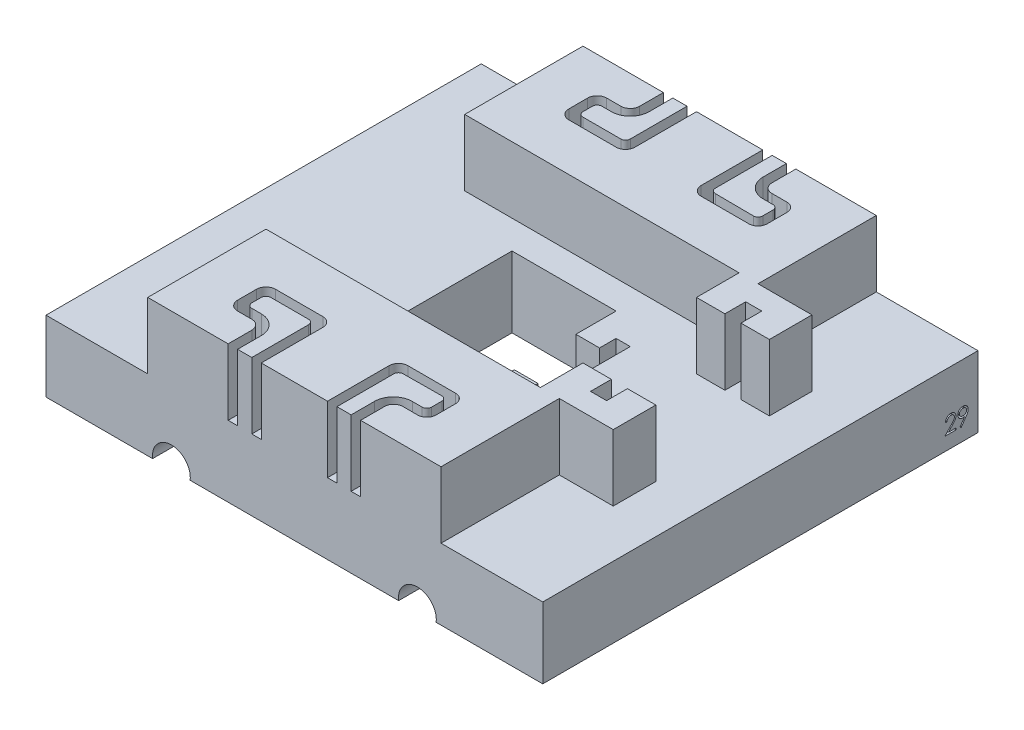
from build123d import *

# Parameters (mm, degrees)
SKETCH1_W               = 105
SKETCH1_H               = 92
BOSS_EXTRUDE1_DEPTH     = 15
SKETCH2_W               = 30
SKETCH2_H               = 30
CUT_EXTRUDE1_DEPTH      = 72
BOSS_EXTRUDE4_DEPTH     = 15
CUT_EXTRUDE2_DEPTH      = 84
CUT_EXTRUDE2_DEPTH_BACK = 64
SKETCH18_R              = 4
CUT_EXTRUDE3_DEPTH      = 10
CUT_EXTRUDE3_DEPTH_BACK = 10
SKETCH22_R              = 6
CUT_EXTRUDE4_DEPTH      = 10
CUT_EXTRUDE4_DEPTH_BACK = 10
SKETCH23_R              = 6
CUT_EXTRUDE5_DEPTH      = 10
CUT_EXTRUDE5_DEPTH_BACK = 10
SKETCH24_R              = 6
CUT_EXTRUDE7_DEPTH      = 2
CUT_EXTRUDE8_DEPTH      = 2
BOSS_EXTRUDE5_DEPTH     = 14


with BuildPart() as part:
    # Sketch1 → Boss-Extrude1 (new body)
    with BuildSketch(Plane(origin=(0, 0, 0), x_dir=(1, 0, 0), z_dir=(0, 1, 0))):
        with Locations((52.5, 46)):
            Rectangle(SKETCH1_W, SKETCH1_H)
    extrude(amount=BOSS_EXTRUDE1_DEPTH)

    # Sketch2 → Cut-Extrude1 (cut)
    with BuildSketch(Plane(origin=(0, 15, 0), x_dir=(1, 0, 0), z_dir=(0, 1, 0))):
        with Locations((52.5, 46)):
            Rectangle(SKETCH2_W, SKETCH2_H)
    extrude(amount=-CUT_EXTRUDE1_DEPTH, mode=Mode.SUBTRACT)

    # Sketch15 → Boss-Extrude4 (add)
    with BuildSketch(Plane(origin=(0, 15, 0), x_dir=(1, 0, 0), z_dir=(0, 1, 0))):
        Polygon((72.5, 67), (72.5, 46), (72.5, 25), (59.5, 25), (59.5, 31), (59.5, 39.5), (64.5, 39.5), (64.5, 36), (67.5, 36), (67.5, 46), (67.5, 56), (64.5, 56), (64.5, 52.5), (59.5, 52.5), (59.5, 61), (59.5, 67), align=None)
    extrude(amount=-BOSS_EXTRUDE4_DEPTH)

    # Sketch18 → Cut-Extrude2 (cut, two sides: drawn at the far end of the back side and taken through both)
    with BuildSketch(Plane.XY.offset(-46).offset(-CUT_EXTRUDE2_DEPTH_BACK)):
        with Locations((26.5, 0.5)):
            Circle(SKETCH18_R)
        with Locations((78.5, 0.5)):
            Circle(SKETCH18_R)
    extrude(amount=CUT_EXTRUDE2_DEPTH + CUT_EXTRUDE2_DEPTH_BACK, mode=Mode.SUBTRACT)

    # Sketch22 → Cut-Extrude3 (cut, two sides: drawn at the far end of the back side and taken through both)
    with BuildSketch(Plane.XY.offset(-46).offset(-CUT_EXTRUDE3_DEPTH_BACK)):
        with Locations((26.5, 0.5)):
            Circle(SKETCH22_R)
    extrude(amount=CUT_EXTRUDE3_DEPTH + CUT_EXTRUDE3_DEPTH_BACK, mode=Mode.SUBTRACT)

    # Sketch23 → Cut-Extrude4 (cut, two sides: drawn at the far end of the back side and taken through both)
    with BuildSketch(Plane(origin=(0, 0, -69), x_dir=(-1, 0, 0), z_dir=(0, 0, -1)).offset(-CUT_EXTRUDE4_DEPTH_BACK)):
        with Locations((-78.5, 0.5)):
            Circle(SKETCH23_R)
    extrude(amount=CUT_EXTRUDE4_DEPTH + CUT_EXTRUDE4_DEPTH_BACK, mode=Mode.SUBTRACT)

    # Sketch24 → Cut-Extrude5 (cut, two sides: drawn at the far end of the back side and taken through both)
    with BuildSketch(Plane.XY.offset(-23).offset(-CUT_EXTRUDE5_DEPTH_BACK)):
        with Locations((78.5, 0.5)):
            Circle(SKETCH24_R)
    extrude(amount=CUT_EXTRUDE5_DEPTH + CUT_EXTRUDE5_DEPTH_BACK, mode=Mode.SUBTRACT)

    # Sketch27 → Cut-Extrude7 (cut)
    # profile 1 of 2: a face of its own
    with BuildSketch(Plane.ZY):
        with BuildLine():
            Line((-6.628929061, 4.581451926), (-6.943031625, 4.581451926))
            add(Edge.make_bspline(
                [(-6.943031625, 4.581451926), (-6.940984472, 4.623122814), (-6.936963918, 4.704963329), (-6.918135629, 4.824287235), (-6.891194752, 4.938342034), (-6.853103298, 5.046211948), (-6.80579702, 5.148850755), (-6.749066993, 5.245850771), (-6.681873142, 5.336841959), (-6.605666408, 5.420980803), (-6.522897769, 5.498168374), (-6.43359183, 5.564823616), (-6.339746802, 5.621141288), (-6.241647403, 5.66822253), (-6.13818684, 5.703562375), (-6.030303982, 5.729784015), (-5.917524846, 5.745560361), (-5.840684824, 5.747256146), (-5.801605343, 5.748118593)],
                knots=[0, 0, 0, 0, 1.10065271, 2.161652631, 3.183658789, 4.190468796, 5.17591951, 6.163126047, 7.15150782, 8.156236427, 9.156009102, 10.134482811, 11.092018607, 12.041330605, 13.001268258, 13.972401359, 14.968799086, 16, 16, 16, 16], degree=3))
            add(Edge.make_bspline(
                [(-5.801605343, 5.748118593), (-5.763227269, 5.747220137), (-5.687815725, 5.745454702), (-5.57775371, 5.730293673), (-5.472976416, 5.706548081), (-5.373688649, 5.673232665), (-5.280682585, 5.628448237), (-5.19325954, 5.574650699), (-5.110378729, 5.512430867), (-5.035771946, 5.439177054), (-4.967263866, 5.360974669), (-4.908161611, 5.277486766), (-4.857548448, 5.19125748), (-4.815360768, 5.101629278), (-4.784304629, 5.00775825), (-4.760726421, 4.911011047), (-4.747399007, 4.810386236), (-4.745353584, 4.74227968), (-4.744313677, 4.707653849)],
                knots=[0, 0, 0, 0, 1.111607364, 2.184268762, 3.212621178, 4.221274766, 5.211760367, 6.196651075, 7.1921475, 8.207485113, 9.220403448, 10.201281604, 11.166441695, 12.114753415, 13.065576456, 14.026450734, 14.996634279, 16, 16, 16, 16], degree=3))
            add(Edge.make_bspline(
                [(-4.744313677, 4.707653849), (-4.74600694, 4.658906015), (-4.749363751, 4.562265801), (-4.778078128, 4.420250938), (-4.822924639, 4.282657519), (-4.876921995, 4.171920217), (-4.93139444, 4.082686724), (-4.980481947, 4.009218019), (-5.037946758, 3.93011255), (-5.104625256, 3.845635213), (-5.179138128, 3.755124308), (-5.262160292, 3.658634512), (-5.354283774, 3.557162743), (-5.418942274, 3.487857141), (-5.45244669, 3.451944715)],
                knots=[0, 0, 0, 0, 1.184426356, 2.348067706, 3.509069118, 4.696110526, 5.333549288, 6.050745305, 6.844228056, 7.710549037, 8.667450064, 9.695053472, 10.805634456, 12, 12, 12, 12], degree=3))
            Line((-5.45244669, 3.451944715), (-6.328147811, 2.517349362))
            Line((-6.328147811, 2.517349362), (-4.699441882, 2.517349362))
            Line((-4.699441882, 2.517349362), (-4.699441882, 2.158375003))
            Line((-4.699441882, 2.158375003), (-7.07764701, 2.158375003))
            Line((-7.07764701, 2.158375003), (-5.720275215, 3.606892632))
            add(Edge.make_bspline(
                [(-5.720275215, 3.606892632), (-5.687227328, 3.641390938), (-5.623749101, 3.707655125), (-5.533966524, 3.804398085), (-5.453327536, 3.894147626), (-5.381310143, 3.976734174), (-5.319476638, 4.053365742), (-5.264604406, 4.121560445), (-5.220638815, 4.184314896), (-5.172923419, 4.25705551), (-5.126709438, 4.345867827), (-5.086997082, 4.454401516), (-5.062782234, 4.566128769), (-5.059877398, 4.641630806), (-5.058416241, 4.679608978)],
                knots=[0, 0, 0, 0, 1.329631726, 2.553950428, 3.673215718, 4.687767853, 5.603093632, 6.413772471, 7.123043292, 7.734684054, 8.834405432, 9.900288307, 10.943827018, 12, 12, 12, 12], degree=3))
            add(Edge.make_bspline(
                [(-5.058416241, 4.679608978), (-5.059051983, 4.703490376), (-5.060304909, 4.750556026), (-5.071362607, 4.819561785), (-5.088073113, 4.886126599), (-5.112018371, 4.950455218), (-5.143625111, 5.01190087), (-5.182098491, 5.070538351), (-5.226488554, 5.127227316), (-5.277839824, 5.180380614), (-5.334251343, 5.229061819), (-5.393845593, 5.272185905), (-5.456895697, 5.308225016), (-5.523135819, 5.337768513), (-5.592381289, 5.360943894), (-5.664766034, 5.377002473), (-5.74009005, 5.387084957), (-5.791523546, 5.388449129), (-5.817731145, 5.389144234)],
                knots=[0, 0, 0, 0, 0.991446411, 1.95395049, 2.89581595, 3.838931463, 4.798493298, 5.75982156, 6.748411868, 7.785213223, 8.824556874, 9.840280684, 10.836137867, 11.835679398, 12.848801643, 13.863922112, 14.911575587, 16, 16, 16, 16], degree=3))
            add(Edge.make_bspline(
                [(-5.817731145, 5.389144234), (-5.845101977, 5.388429202), (-5.898853774, 5.387024997), (-5.977772807, 5.377202333), (-6.053058584, 5.360256492), (-6.124900487, 5.337079818), (-6.193420073, 5.307621269), (-6.258284117, 5.270929524), (-6.319347006, 5.227146031), (-6.37672353, 5.177505475), (-6.429587509, 5.122237874), (-6.476034384, 5.06062791), (-6.516618399, 4.993800495), (-6.552027632, 4.921935945), (-6.580783322, 4.844382165), (-6.602756473, 4.76141446), (-6.620143319, 4.673393078), (-6.62595184, 4.612607993), (-6.628929061, 4.581451926)],
                knots=[0, 0, 0, 0, 1.031018746, 2.02475058, 2.990194455, 3.934040569, 4.864654155, 5.795059489, 6.735614925, 7.690564532, 8.649604399, 9.611025574, 10.590972636, 11.591080095, 12.624614302, 13.701020113, 14.821632451, 16, 16, 16, 16], degree=3))
        make_face()
    # profile 2 of 2: a face of its own
    with BuildSketch(Plane.ZY):
        with BuildLine():
            Line((-3.622518805, 2.068631414), (-3.873520408, 2.24321074))
            Line((-3.873520408, 2.24321074), (-2.900363356, 3.665786862))
            add(Edge.make_bspline(
                [(-2.900363356, 3.665786862), (-2.962454092, 3.658193799), (-3.084714212, 3.643242634), (-3.207851314, 3.640495979), (-3.268452299, 3.639144234)],
                knots=[0, 0, 0, 0, 1.015715272, 2, 2, 2, 2], degree=3))
            add(Edge.make_bspline(
                [(-3.268452299, 3.639144234), (-3.305194346, 3.640085311), (-3.377315773, 3.641932561), (-3.483347426, 3.65657437), (-3.585232986, 3.679124497), (-3.682702342, 3.712773252), (-3.776121847, 3.754591461), (-3.86528756, 3.806448475), (-3.950079451, 3.867454767), (-4.029586861, 3.937287758), (-4.1018986, 4.013965811), (-4.166321898, 4.095121454), (-4.21986303, 4.181697424), (-4.264339615, 4.271927644), (-4.298070068, 4.367108995), (-4.322632606, 4.466158395), (-4.33775496, 4.569770037), (-4.339554056, 4.640295168), (-4.340467523, 4.676103369)],
                knots=[0, 0, 0, 0, 1.060718605, 2.082097864, 3.085795603, 4.069760067, 5.054557537, 6.03741023, 7.043284206, 8.066802108, 9.088538119, 10.083643548, 11.053783639, 12.022749082, 12.983451788, 13.964007469, 14.966251758, 16, 16, 16, 16], degree=3))
            add(Edge.make_bspline(
                [(-4.340467523, 4.676103369), (-4.338733088, 4.725072021), (-4.335328744, 4.821187553), (-4.307930227, 4.961621322), (-4.262869888, 5.094407866), (-4.200041511, 5.21919806), (-4.12090679, 5.334196799), (-4.0257982, 5.437805408), (-3.915294235, 5.528550262), (-3.791912216, 5.606554339), (-3.658559195, 5.669289336), (-3.518890537, 5.715528637), (-3.373976417, 5.742727385), (-3.275808747, 5.746313246), (-3.226384991, 5.748118593)],
                knots=[0, 0, 0, 0, 1.022988612, 2.007919123, 2.978103895, 3.94594894, 4.918897164, 5.887013414, 6.875921846, 7.89917871, 8.930658928, 9.948724884, 10.967259574, 12, 12, 12, 12], degree=3))
            add(Edge.make_bspline(
                [(-3.226384991, 5.748118593), (-3.177896571, 5.74628843), (-3.082088024, 5.7426722), (-2.941199018, 5.716188231), (-2.806258001, 5.671551558), (-2.678013014, 5.609866995), (-2.559273602, 5.532546087), (-2.452497791, 5.440411563), (-2.360122252, 5.333406036), (-2.282298371, 5.214117546), (-2.219828331, 5.085950565), (-2.174756048, 4.952166642), (-2.147010409, 4.813727921), (-2.143514082, 4.719933447), (-2.141749574, 4.67259776)],
                knots=[0, 0, 0, 0, 1.026385292, 2.028040595, 3.023318987, 4.028184125, 5.03290303, 6.015178782, 7.004435299, 8.016004309, 9.023023918, 10.015172535, 10.998308025, 12, 12, 12, 12], degree=3))
            add(Edge.make_bspline(
                [(-2.141749574, 4.67259776), (-2.142927983, 4.635853993), (-2.145318091, 4.561328452), (-2.162054398, 4.448098109), (-2.190474583, 4.33264688), (-2.222726282, 4.234925284), (-2.25385845, 4.154216834), (-2.283159581, 4.090465254), (-2.315671735, 4.023363991), (-2.3535905, 3.953616653), (-2.394352797, 3.880334118), (-2.440412074, 3.804251402), (-2.490717645, 3.725266409), (-2.526547365, 3.672019321), (-2.544894606, 3.644753208)],
                knots=[0, 0, 0, 0, 1.179839688, 2.393009684, 3.667231171, 4.993948276, 5.694988576, 6.444077775, 7.246288328, 8.089075292, 8.993003841, 9.939041771, 10.944649915, 12, 12, 12, 12], degree=3))
            Line((-2.544894606, 3.644753208), (-3.622518805, 2.068631414))
        make_face()
        with BuildLine():
            add(Edge.make_bspline(
                [(-3.21025919, 3.998118593), (-3.182425175, 3.998878977), (-3.128241812, 4.000359186), (-3.048864513, 4.009368427), (-2.97394031, 4.025342414), (-2.903269061, 4.048262126), (-2.836142159, 4.075918794), (-2.773625831, 4.111130781), (-2.715667755, 4.153147415), (-2.661879828, 4.200357431), (-2.614115829, 4.252808015), (-2.571572798, 4.307705121), (-2.53541223, 4.365289731), (-2.506848953, 4.426282994), (-2.483364378, 4.489200202), (-2.467146366, 4.555054557), (-2.458162033, 4.623502958), (-2.456630458, 4.670001616), (-2.455852138, 4.693631414)],
                knots=[0, 0, 0, 0, 1.163407946, 2.26475976, 3.333800367, 4.359385343, 5.366239384, 6.363380779, 7.350133999, 8.353570782, 9.349036268, 10.310270964, 11.253520213, 12.184142, 13.120487599, 14.056272588, 15.012232024, 16, 16, 16, 16], degree=3))
            add(Edge.make_bspline(
                [(-2.455852138, 4.693631414), (-2.456521807, 4.717271079), (-2.457841473, 4.763855939), (-2.468428772, 4.832405679), (-2.487053996, 4.898098939), (-2.51204448, 4.961295369), (-2.544964718, 5.021475741), (-2.584468204, 5.079395613), (-2.631400654, 5.134687741), (-2.68540322, 5.186051724), (-2.743637773, 5.233399624), (-2.805698273, 5.2751857), (-2.871073189, 5.310206896), (-2.939363679, 5.339105866), (-3.010712028, 5.361657642), (-3.085076016, 5.377875006), (-3.162831422, 5.386846761), (-3.215612708, 5.388368655), (-3.242510792, 5.389144234)],
                knots=[0, 0, 0, 0, 0.972161553, 1.915763587, 2.844109794, 3.775983486, 4.705125789, 5.659731448, 6.655561913, 7.682237399, 8.721216875, 9.739758359, 10.754845918, 11.767244016, 12.7857855, 13.828538656, 14.893392813, 16, 16, 16, 16], degree=3))
            add(Edge.make_bspline(
                [(-3.242510792, 5.389144234), (-3.269174946, 5.388367402), (-3.321489795, 5.386843265), (-3.398553954, 5.37789206), (-3.472415122, 5.361548576), (-3.543556742, 5.339116312), (-3.611845203, 5.31020474), (-3.677217036, 5.275183865), (-3.739292052, 5.233409242), (-3.797470773, 5.18601447), (-3.851568695, 5.134926824), (-3.897694224, 5.079153395), (-3.937288116, 5.02150587), (-3.970163119, 4.961287362), (-3.995165636, 4.898101077), (-4.013787638, 4.8324051), (-4.024375803, 4.76385609), (-4.02569535, 4.71727113), (-4.026364959, 4.693631414)],
                knots=[0, 0, 0, 0, 1.099389452, 2.15699305, 3.192601482, 4.213358962, 5.227959689, 6.245255729, 7.266013209, 8.307253147, 9.336162325, 10.327954924, 11.284637477, 12.215801273, 13.149702402, 14.080068371, 15.025723358, 16, 16, 16, 16], degree=3))
            add(Edge.make_bspline(
                [(-4.026364959, 4.693631414), (-4.025759033, 4.669983215), (-4.024564036, 4.623344639), (-4.013036246, 4.554818246), (-3.993757966, 4.489130052), (-3.967938575, 4.425641345), (-3.933936985, 4.364969487), (-3.892213137, 4.307402125), (-3.843307591, 4.252286675), (-3.787874104, 4.200479463), (-3.727205943, 4.152927287), (-3.662409196, 4.111396905), (-3.59459936, 4.076324461), (-3.523537729, 4.048183077), (-3.449750929, 4.025571413), (-3.372575798, 4.009397868), (-3.29226756, 4.000445601), (-3.237857578, 3.998901704), (-3.21025919, 3.998118593)],
                knots=[0, 0, 0, 0, 0.952633368, 1.87876736, 2.791047057, 3.707742249, 4.635551637, 5.587206343, 6.568248508, 7.601284464, 8.641511608, 9.671105535, 10.699146789, 11.713763218, 12.747829548, 13.806491675, 14.887386225, 16, 16, 16, 16], degree=3))
        make_face(mode=Mode.SUBTRACT)
    extrude(amount=-CUT_EXTRUDE7_DEPTH, mode=Mode.SUBTRACT)

    # Sketch28 → Cut-Extrude8 (cut)
    # profile 1 of 2: a face of its own
    with BuildSketch(Plane(origin=(105, 0, 0), x_dir=(0, 0, -1), z_dir=(1, 0, 0))):
        with BuildLine():
            Line((85.444393694, 5.241356725), (85.13029113, 5.241356725))
            add(Edge.make_bspline(
                [(85.13029113, 5.241356725), (85.132338283, 5.283027613), (85.136358837, 5.364868127), (85.155187126, 5.484192034), (85.182128003, 5.598246832), (85.220219457, 5.706116746), (85.267525735, 5.808755554), (85.324255763, 5.905755569), (85.391449613, 5.996746758), (85.467656347, 6.080885601), (85.550424986, 6.158073172), (85.639730926, 6.224728415), (85.733575953, 6.281046086), (85.831675352, 6.328127328), (85.935135915, 6.363467174), (86.043018773, 6.389688814), (86.15579791, 6.405465159), (86.232637932, 6.407160945), (86.271717412, 6.408023392)],
                knots=[0, 0, 0, 0, 1.10065271, 2.161652631, 3.183658789, 4.190468796, 5.17591951, 6.163126047, 7.15150782, 8.156236427, 9.156009102, 10.134482811, 11.092018607, 12.041330605, 13.001268258, 13.972401359, 14.968799086, 16, 16, 16, 16], degree=3))
            add(Edge.make_bspline(
                [(86.271717412, 6.408023392), (86.310095486, 6.407124935), (86.385507031, 6.4053595), (86.495569045, 6.390198471), (86.60034634, 6.366452879), (86.699634106, 6.333137463), (86.792640171, 6.288353036), (86.880063215, 6.234555497), (86.962944026, 6.172335666), (87.03755081, 6.099081852), (87.106058889, 6.020879468), (87.165161144, 5.937391564), (87.215774308, 5.851162278), (87.257961987, 5.761534077), (87.289018126, 5.667663048), (87.312596334, 5.570915846), (87.325923748, 5.470291035), (87.327969172, 5.402184479), (87.329009079, 5.367558648)],
                knots=[0, 0, 0, 0, 1.111607364, 2.184268762, 3.212621178, 4.221274766, 5.211760367, 6.196651075, 7.1921475, 8.207485113, 9.220403448, 10.201281604, 11.166441695, 12.114753415, 13.065576456, 14.026450734, 14.996634279, 16, 16, 16, 16], degree=3))
            add(Edge.make_bspline(
                [(87.329009079, 5.367558648), (87.327315816, 5.318810813), (87.323959004, 5.2221706), (87.295244628, 5.080155737), (87.250398117, 4.942562318), (87.19640076, 4.831825016), (87.141928316, 4.742591522), (87.092840808, 4.669122817), (87.035375997, 4.590017349), (86.968697499, 4.505540011), (86.894184627, 4.415029106), (86.811162464, 4.318539311), (86.719038982, 4.217067541), (86.654380481, 4.14776194), (86.620876066, 4.111849513)],
                knots=[0, 0, 0, 0, 1.184426356, 2.348067706, 3.509069118, 4.696110526, 5.333549288, 6.050745305, 6.844228056, 7.710549037, 8.667450064, 9.695053472, 10.805634456, 12, 12, 12, 12], degree=3))
            Line((86.620876066, 4.111849513), (85.745174944, 3.177254161))
            Line((85.745174944, 3.177254161), (87.373880874, 3.177254161))
            Line((87.373880874, 3.177254161), (87.373880874, 2.818279802))
            Line((87.373880874, 2.818279802), (84.995675745, 2.818279802))
            Line((84.995675745, 2.818279802), (86.35304754, 4.26679743))
            add(Edge.make_bspline(
                [(86.35304754, 4.26679743), (86.386095427, 4.301295737), (86.449573654, 4.367559923), (86.539356231, 4.464302883), (86.619995219, 4.554052424), (86.692012612, 4.636638973), (86.753846117, 4.71327054), (86.808718349, 4.781465244), (86.85268394, 4.844219694), (86.900399336, 4.916960308), (86.946613317, 5.005772625), (86.986325673, 5.114306315), (87.010540522, 5.226033567), (87.013445357, 5.301535604), (87.014906515, 5.339513776)],
                knots=[0, 0, 0, 0, 1.329631726, 2.553950428, 3.673215718, 4.687767853, 5.603093632, 6.413772471, 7.123043292, 7.734684054, 8.834405432, 9.900288307, 10.943827018, 12, 12, 12, 12], degree=3))
            add(Edge.make_bspline(
                [(87.014906515, 5.339513776), (87.014270772, 5.363395175), (87.013017846, 5.410460825), (87.001960149, 5.479466584), (86.985249643, 5.546031398), (86.961304385, 5.610360017), (86.929697645, 5.671805669), (86.891224265, 5.730443149), (86.846834201, 5.787132114), (86.795482932, 5.840285412), (86.739071412, 5.888966618), (86.679477162, 5.932090703), (86.616427058, 5.968129814), (86.550186936, 5.997673311), (86.480941467, 6.020848693), (86.408556721, 6.036907272), (86.333232705, 6.046989756), (86.28179921, 6.048353928), (86.255591611, 6.049049033)],
                knots=[0, 0, 0, 0, 0.991446411, 1.95395049, 2.89581595, 3.838931463, 4.798493298, 5.75982156, 6.748411868, 7.785213223, 8.824556874, 9.840280684, 10.836137867, 11.835679398, 12.848801643, 13.863922112, 14.911575587, 16, 16, 16, 16], degree=3))
            add(Edge.make_bspline(
                [(86.255591611, 6.049049033), (86.228220778, 6.048334), (86.174468982, 6.046929795), (86.095549949, 6.037107131), (86.020264171, 6.020161291), (85.948422268, 5.996984616), (85.879902682, 5.967526067), (85.815038638, 5.930834323), (85.753975749, 5.88705083), (85.696599226, 5.837410273), (85.643735247, 5.782142672), (85.597288371, 5.720532709), (85.556704357, 5.653705294), (85.521295123, 5.581840743), (85.492539433, 5.504286963), (85.470566283, 5.421319258), (85.453179436, 5.333297877), (85.447370915, 5.272512792), (85.444393694, 5.241356725)],
                knots=[0, 0, 0, 0, 1.031018746, 2.02475058, 2.990194455, 3.934040569, 4.864654155, 5.795059489, 6.735614925, 7.690564532, 8.649604399, 9.611025574, 10.590972636, 11.591080095, 12.624614302, 13.701020113, 14.821632451, 16, 16, 16, 16], degree=3))
        make_face()
    # profile 2 of 2: a face of its own
    with BuildSketch(Plane(origin=(105, 0, 0), x_dir=(0, 0, -1), z_dir=(1, 0, 0))):
        with BuildLine():
            Line((88.45080395, 2.728536212), (88.199802348, 2.903115539))
            Line((88.199802348, 2.903115539), (89.172959399, 4.325691661))
            add(Edge.make_bspline(
                [(89.172959399, 4.325691661), (89.110868664, 4.318098598), (88.988608543, 4.303147433), (88.865471441, 4.300400778), (88.804870457, 4.299049033)],
                knots=[0, 0, 0, 0, 1.015715272, 2, 2, 2, 2], degree=3))
            add(Edge.make_bspline(
                [(88.804870457, 4.299049033), (88.768128409, 4.299990109), (88.696006982, 4.30183736), (88.58997533, 4.316479168), (88.488089769, 4.339029296), (88.390620413, 4.372678051), (88.297200908, 4.41449626), (88.208035195, 4.466353274), (88.123243304, 4.527359565), (88.043735894, 4.597192557), (87.971424156, 4.673870609), (87.907000858, 4.755026252), (87.853459726, 4.841602223), (87.80898314, 4.931832442), (87.775252687, 5.027013793), (87.750690149, 5.126063193), (87.735567795, 5.229674835), (87.733768699, 5.300199966), (87.732855232, 5.336008167)],
                knots=[0, 0, 0, 0, 1.060718605, 2.082097864, 3.085795603, 4.069760067, 5.054557537, 6.03741023, 7.043284206, 8.066802108, 9.088538119, 10.083643548, 11.053783639, 12.022749082, 12.983451788, 13.964007469, 14.966251758, 16, 16, 16, 16], degree=3))
            add(Edge.make_bspline(
                [(87.732855232, 5.336008167), (87.734589667, 5.38497682), (87.737994011, 5.481092352), (87.765392528, 5.621526121), (87.810452867, 5.754312664), (87.873281244, 5.879102858), (87.952415966, 5.994101597), (88.047524556, 6.097710206), (88.15802852, 6.18845506), (88.281410539, 6.266459138), (88.41476356, 6.329194135), (88.554432218, 6.375433435), (88.699346338, 6.402632183), (88.797514008, 6.406218044), (88.846937765, 6.408023392)],
                knots=[0, 0, 0, 0, 1.022988612, 2.007919123, 2.978103895, 3.94594894, 4.918897164, 5.887013414, 6.875921846, 7.89917871, 8.930658928, 9.948724884, 10.967259574, 12, 12, 12, 12], degree=3))
            add(Edge.make_bspline(
                [(88.846937765, 6.408023392), (88.895426184, 6.406193229), (88.991234731, 6.402576999), (89.132123738, 6.37609303), (89.267064754, 6.331456357), (89.395309741, 6.269771793), (89.514049153, 6.192450886), (89.620824965, 6.100316362), (89.713200504, 5.993310835), (89.791024384, 5.874022345), (89.853494425, 5.745855363), (89.898566708, 5.612071441), (89.926312347, 5.47363272), (89.929808674, 5.379838245), (89.931573181, 5.332502558)],
                knots=[0, 0, 0, 0, 1.026385292, 2.028040595, 3.023318987, 4.028184125, 5.03290303, 6.015178782, 7.004435299, 8.016004309, 9.023023918, 10.015172535, 10.998308025, 12, 12, 12, 12], degree=3))
            add(Edge.make_bspline(
                [(89.931573181, 5.332502558), (89.930394772, 5.295758791), (89.928004665, 5.22123325), (89.911268357, 5.108002908), (89.882848172, 4.992551678), (89.850596474, 4.894830082), (89.819464306, 4.814121633), (89.790163174, 4.750370053), (89.757651021, 4.683268789), (89.719732255, 4.613521451), (89.678969958, 4.540238916), (89.632910682, 4.464156201), (89.58260511, 4.385171208), (89.54677539, 4.331924119), (89.528428149, 4.304658007)],
                knots=[0, 0, 0, 0, 1.179839688, 2.393009684, 3.667231171, 4.993948276, 5.694988576, 6.444077775, 7.246288328, 8.089075292, 8.993003841, 9.939041771, 10.944649915, 12, 12, 12, 12], degree=3))
            Line((89.528428149, 4.304658007), (88.45080395, 2.728536212))
        make_face()
        with BuildLine():
            add(Edge.make_bspline(
                [(88.863063566, 4.658023392), (88.89089758, 4.658783775), (88.945080943, 4.660263984), (89.024458242, 4.669273226), (89.099382445, 4.685247212), (89.170053695, 4.708166924), (89.237180597, 4.735823593), (89.299696925, 4.771035579), (89.357655, 4.813052214), (89.411442927, 4.86026223), (89.459206927, 4.912712813), (89.501749958, 4.96760992), (89.537910525, 5.02519453), (89.566473802, 5.086187792), (89.589958378, 5.149105001), (89.60617639, 5.214959356), (89.615160723, 5.283407757), (89.616692298, 5.329906415), (89.617470617, 5.353536212)],
                knots=[0, 0, 0, 0, 1.163407946, 2.26475976, 3.333800367, 4.359385343, 5.366239384, 6.363380779, 7.350133999, 8.353570782, 9.349036268, 10.310270964, 11.253520213, 12.184142, 13.120487599, 14.056272588, 15.012232024, 16, 16, 16, 16], degree=3))
            add(Edge.make_bspline(
                [(89.617470617, 5.353536212), (89.616800948, 5.377175877), (89.615481283, 5.423760737), (89.604893983, 5.492310477), (89.58626876, 5.558003738), (89.561278275, 5.621200168), (89.528358037, 5.68138054), (89.488854552, 5.739300412), (89.441922102, 5.794592539), (89.387919536, 5.845956523), (89.329684983, 5.893304422), (89.267624482, 5.935090498), (89.202249566, 5.970111695), (89.133959077, 5.999010664), (89.062610728, 6.02156244), (88.988246739, 6.037779805), (88.910491334, 6.046751559), (88.857710048, 6.048273454), (88.830811963, 6.049049033)],
                knots=[0, 0, 0, 0, 0.972161553, 1.915763587, 2.844109794, 3.775983486, 4.705125789, 5.659731448, 6.655561913, 7.682237399, 8.721216875, 9.739758359, 10.754845918, 11.767244016, 12.7857855, 13.828538656, 14.893392813, 16, 16, 16, 16], degree=3))
            add(Edge.make_bspline(
                [(88.830811963, 6.049049033), (88.80414781, 6.048272201), (88.751832961, 6.046748064), (88.674768801, 6.037796858), (88.600907633, 6.021453374), (88.529766013, 5.99902111), (88.461477552, 5.970109539), (88.39610572, 5.935088663), (88.334030703, 5.893314041), (88.275851982, 5.845919268), (88.22175406, 5.794831622), (88.175628531, 5.739058193), (88.136034639, 5.681410669), (88.103159636, 5.621192161), (88.078157119, 5.558005875), (88.059535117, 5.492309898), (88.048946952, 5.423760888), (88.047627406, 5.377175928), (88.046957797, 5.353536212)],
                knots=[0, 0, 0, 0, 1.099389452, 2.15699305, 3.192601482, 4.213358962, 5.227959689, 6.245255729, 7.266013209, 8.307253147, 9.336162325, 10.327954924, 11.284637477, 12.215801273, 13.149702402, 14.080068371, 15.025723358, 16, 16, 16, 16], degree=3))
            add(Edge.make_bspline(
                [(88.046957797, 5.353536212), (88.047563723, 5.329888013), (88.04875872, 5.283249437), (88.06028651, 5.214723044), (88.079564789, 5.14903485), (88.10538418, 5.085546143), (88.13938577, 5.024874285), (88.181109618, 4.967306923), (88.230015164, 4.912191473), (88.285448652, 4.860384261), (88.346116813, 4.812832086), (88.410913559, 4.771301704), (88.478723396, 4.736229259), (88.549785027, 4.708087875), (88.623571826, 4.685476212), (88.700746958, 4.669302667), (88.781055195, 4.6603504), (88.835465177, 4.658806503), (88.863063566, 4.658023392)],
                knots=[0, 0, 0, 0, 0.952633368, 1.87876736, 2.791047057, 3.707742249, 4.635551637, 5.587206343, 6.568248508, 7.601284464, 8.641511608, 9.671105535, 10.699146789, 11.713763218, 12.747829548, 13.806491675, 14.887386225, 16, 16, 16, 16], degree=3))
        make_face(mode=Mode.SUBTRACT)
    extrude(amount=-CUT_EXTRUDE8_DEPTH, mode=Mode.SUBTRACT)

    # Sketch29 → Boss-Extrude5 (add)
    with BuildSketch(Plane(origin=(0, 15, 0), x_dir=(1, 0, 0), z_dir=(0, 1, 0))):
        with BuildLine():
            Line((40.5, 0), (43.5, 0))
            Line((43.5, 0), (43.5, 12))
            ThreePointArc((43.5, 12), (43.207106781, 12.707106781), (42.5, 13))
            Line((42.5, 13), (34.5, 13))
            ThreePointArc((34.5, 13), (33.792893219, 12.707106781), (33.5, 12))
            Line((33.5, 12), (33.5, 10))
            ThreePointArc((33.5, 10), (33.792893219, 9.292893219), (34.5, 9))
            Line((34.5, 9), (36.5, 9))
            ThreePointArc((36.5, 9), (39.328427125, 7.828427125), (40.5, 5))
            Line((40.5, 5), (40.5, 0))
        make_face()
        with BuildLine():
            Line((52.5, 25), (21.5, 25))
            Line((21.5, 25), (21.5, 0))
            Line((21.5, 0), (38.5, 0))
            Line((38.5, 0), (38.5, 5))
            ThreePointArc((38.5, 5), (37.914213562, 6.414213562), (36.5, 7))
            Line((36.5, 7), (33.5, 7))
            ThreePointArc((33.5, 7), (32.085786438, 7.585786438), (31.5, 9))
            Line((31.5, 9), (31.5, 13))
            ThreePointArc((31.5, 13), (32.085786438, 14.414213562), (33.5, 15))
            Line((33.5, 15), (43.5, 15))
            ThreePointArc((43.5, 15), (44.914213562, 14.414213562), (45.5, 13))
            Line((45.5, 13), (45.5, 0))
            Line((45.5, 0), (59.5, 0))
            Line((59.5, 0), (59.5, 13))
            ThreePointArc((59.5, 13), (60.085786438, 14.414213562), (61.5, 15))
            Line((61.5, 15), (71.579958912, 15))
            ThreePointArc((71.579958912, 15), (72.937632986, 14.437632986), (73.5, 13.079958912))
            Line((73.5, 13.079958912), (73.5, 8.920041088))
            ThreePointArc((73.5, 8.920041088), (72.937632986, 7.562367014), (71.579958912, 7))
            Line((71.579958912, 7), (68.420041088, 7))
            ThreePointArc((68.420041088, 7), (67.062367014, 6.437632986), (66.5, 5.079958912))
            Line((66.5, 5.079958912), (66.5, 0))
            Line((66.5, 0), (83.5, 0))
            Line((83.5, 0), (83.5, 25))
            Line((83.5, 25), (94.9, 25))
            Line((94.9, 25), (94.9, 34))
            Line((94.9, 34), (88.9, 34))
            Line((88.9, 34), (88.9, 29.6))
            Line((88.9, 29.6), (85.5, 29.6))
            Line((85.5, 29.6), (85.5, 34))
            Line((85.5, 34), (79.5, 34))
            Line((79.5, 34), (79.5, 25))
            Line((79.5, 25), (52.5, 25))
        make_face()
        with BuildLine():
            Line((61.5, 0), (61.5, 12.007901003))
            ThreePointArc((61.5, 12.007901003), (61.790094297, 12.712197739), (62.492067785, 13.007869542))
            Line((62.492067785, 13.007869542), (70.572026698, 13.071963526))
            ThreePointArc((70.572026698, 13.071963526), (71.284255649, 12.78190069), (71.579958912, 12.071994987))
            Line((71.579958912, 12.071994987), (71.579958912, 9.920041088))
            ThreePointArc((71.579958912, 9.920041088), (71.287065693, 9.212934307), (70.579958912, 8.920041088))
            Line((70.579958912, 8.920041088), (68.5, 8.920041088))
            ThreePointArc((68.5, 8.920041088), (65.671572875, 7.748468212), (64.5, 4.920041088))
            Line((64.5, 4.920041088), (64.5, 0))
            Line((64.5, 0), (61.5, 0))
        make_face()
        with BuildLine():
            Line((88.9, 58), (94.9, 58))
            Line((94.9, 58), (94.9, 67))
            Line((94.9, 67), (83.5, 67))
            Line((83.5, 67), (83.5, 92))
            Line((83.5, 92), (66.5, 92))
            Line((66.5, 92), (66.5, 86.920041088))
            ThreePointArc((66.5, 86.920041088), (67.062367014, 85.562367014), (68.420041088, 85))
            Line((68.420041088, 85), (71.579958912, 85))
            ThreePointArc((71.579958912, 85), (72.937632986, 84.437632986), (73.5, 83.079958912))
            Line((73.5, 83.079958912), (73.5, 78.920041088))
            ThreePointArc((73.5, 78.920041088), (72.937632986, 77.562367014), (71.579958912, 77))
            Line((71.579958912, 77), (61.5, 77))
            ThreePointArc((61.5, 77), (60.085786438, 77.585786438), (59.5, 79))
            Line((59.5, 79), (59.5, 92))
            Line((59.5, 92), (45.5, 92))
            Line((45.5, 92), (45.5, 79))
            ThreePointArc((45.5, 79), (44.914213562, 77.585786438), (43.5, 77))
            Line((43.5, 77), (33.5, 77))
            ThreePointArc((33.5, 77), (32.085786438, 77.585786438), (31.5, 79))
            Line((31.5, 79), (31.5, 83))
            ThreePointArc((31.5, 83), (32.085786438, 84.414213562), (33.5, 85))
            Line((33.5, 85), (36.5, 85))
            ThreePointArc((36.5, 85), (37.914213562, 85.585786438), (38.5, 87))
            Line((38.5, 87), (38.5, 92))
            Line((38.5, 92), (21.5, 92))
            Line((21.5, 92), (21.5, 67))
            Line((21.5, 67), (52.5, 67))
            Line((52.5, 67), (79.5, 67))
            Line((79.5, 67), (79.5, 58))
            Line((79.5, 58), (85.5, 58))
            Line((85.5, 58), (85.5, 62.4))
            Line((85.5, 62.4), (88.9, 62.4))
            Line((88.9, 62.4), (88.9, 58))
        make_face()
        with BuildLine():
            Line((61.5, 92), (64.5, 92))
            Line((64.5, 92), (64.5, 87.079958912))
            ThreePointArc((64.5, 87.079958912), (65.671572875, 84.251531788), (68.5, 83.079958912))
            Line((68.5, 83.079958912), (70.579958912, 83.079958912))
            ThreePointArc((70.579958912, 83.079958912), (71.287065693, 82.787065693), (71.579958912, 82.079958912))
            Line((71.579958912, 82.079958912), (71.579958912, 79.928005013))
            ThreePointArc((71.579958912, 79.928005013), (71.284255649, 79.21809931), (70.572026698, 78.928036474))
            Line((70.572026698, 78.928036474), (62.492067785, 78.992130458))
            ThreePointArc((62.492067785, 78.992130458), (61.790094297, 79.287802261), (61.5, 79.992098997))
            Line((61.5, 79.992098997), (61.5, 92))
        make_face()
        with BuildLine():
            Line((40.5, 87), (40.5, 92))
            Line((40.5, 92), (43.5, 92))
            Line((43.5, 92), (43.5, 80))
            ThreePointArc((43.5, 80), (43.207106781, 79.292893219), (42.5, 79))
            Line((42.5, 79), (34.5, 79))
            ThreePointArc((34.5, 79), (33.792893219, 79.292893219), (33.5, 80))
            Line((33.5, 80), (33.5, 82))
            ThreePointArc((33.5, 82), (33.792893219, 82.707106781), (34.5, 83))
            Line((34.5, 83), (36.5, 83))
            ThreePointArc((36.5, 83), (39.328427125, 84.171572875), (40.5, 87))
        make_face()
    extrude(amount=BOSS_EXTRUDE5_DEPTH)


solid = part.part
